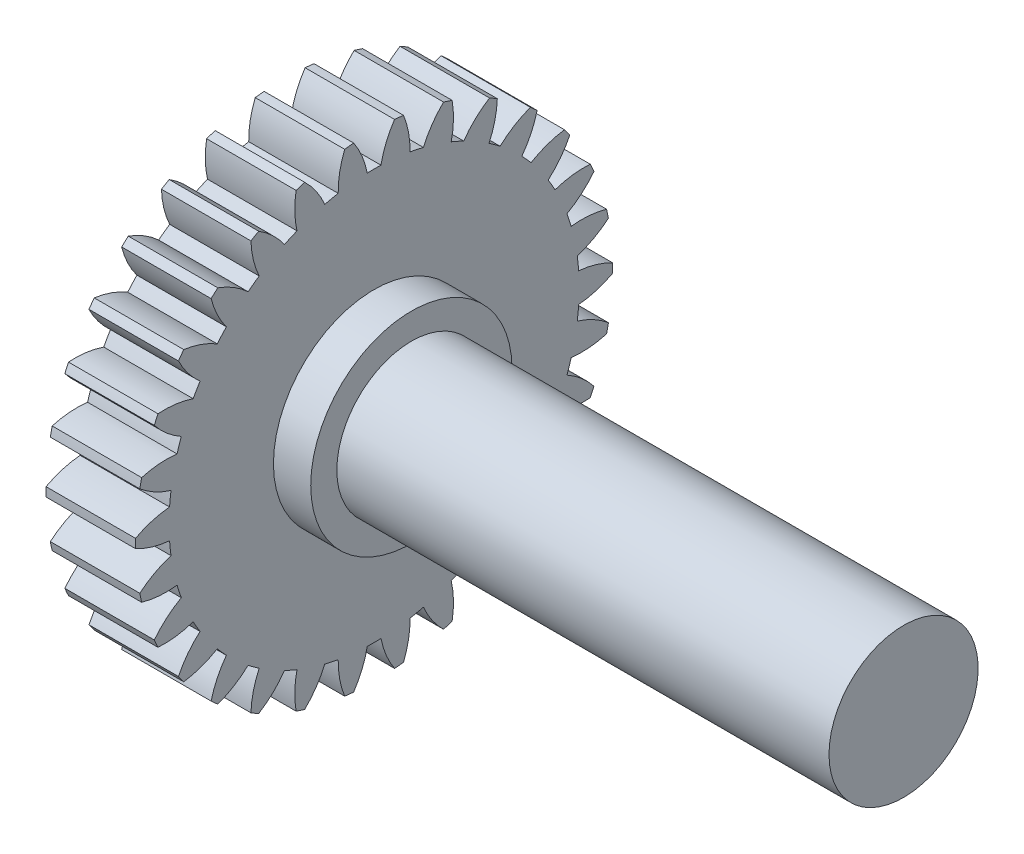
from build123d import *

# Parameters (mm, degrees)
BASPROSKE_W         = 12
BASPROSKE_H         = 32
TOOTHCUT_DEPTH      = 47.818799643
TEETHCUTS_COUNT     = 30
TEETHCUTS_ANGLE     = 348
BORSKE_R            = 10
BORE_DEPTH          = 50.0000508
BOSS_EXTRUDE1_START = -83
SKETCH1_R           = 10
BOSS_EXTRUDE1_DEPTH = 83
SKETCH3_R           = 13.5
BOSS_EXTRUDE2_DEPTH = 5


with BuildPart() as part:
    # BasProSke → Base-Revolve (revolve)
    with BuildSketch(Plane(origin=(0, 0, 0), x_dir=(1, 0, 0), z_dir=(0, 1, 0)), mode=Mode.PRIVATE) as base_revolve_sk:
        with Locations((6, 16)):
            Rectangle(BASPROSKE_W, BASPROSKE_H)
    revolve(base_revolve_sk.sketch.rotate(Axis((-10, 0, 0), (1, 0, 0)), 180), axis=Axis((-10, 0, 0), (1, 0, 0)))

    # TooCutSke → ToothCut (cut, through all)
    with BuildSketch(Plane(origin=(0, 0, 0), x_dir=(0, 0, -1), z_dir=(1, 0, 0))):
        with BuildLine():
            ThreePointArc((0.918551563, 27.483654488), (0, 27.499), (-0.918551563, 27.483654488))
            ThreePointArc((-0.918551563, 27.483654488), (-1.617208176, 29.787801627), (-2.761784709, 31.906093311))
            ThreePointArc((-2.761784709, 31.906093311), (0, 32.0254), (2.761784709, 31.906093311))
            ThreePointArc((2.761784709, 31.906093311), (1.617208176, 29.787801627), (0.918551563, 27.483654488))
        make_face()
    toothcut = extrude(amount=TOOTHCUT_DEPTH, mode=Mode.SUBTRACT)

    # TeethCuts: ToothCut ×30 about axis
    teethcuts_axis = Axis((-10, 0, 0), (1, 0, 0))
    for i in range(1, TEETHCUTS_COUNT):
        add(toothcut.rotate(teethcuts_axis, i * TEETHCUTS_ANGLE / (TEETHCUTS_COUNT - 1)), mode=Mode.SUBTRACT)

    # BorSke → Bore (cut, symmetric)
    with BuildSketch(Plane(origin=(0, 0, 0), x_dir=(0, 0, -1), z_dir=(1, 0, 0))):
        with Locations(Location((0, 0, 0), (0, 0, 180))):
            Circle(BORSKE_R)
    extrude(amount=BORE_DEPTH, both=True, mode=Mode.SUBTRACT)

    # Sketch1 → Boss-Extrude1 (add)
    with BuildSketch(Plane.ZY.offset(BOSS_EXTRUDE1_START)):
        Circle(SKETCH1_R)
    extrude(amount=BOSS_EXTRUDE1_DEPTH)

    # Sketch3 → Boss-Extrude2 (add)
    with BuildSketch(Plane(origin=(12, 0, 0), x_dir=(0, 0, -1), z_dir=(1, 0, 0))):
        with Locations(Location((0, 0, 0), (0, 0, 180))):
            Circle(SKETCH3_R)
    extrude(amount=BOSS_EXTRUDE2_DEPTH)


solid = part.part
